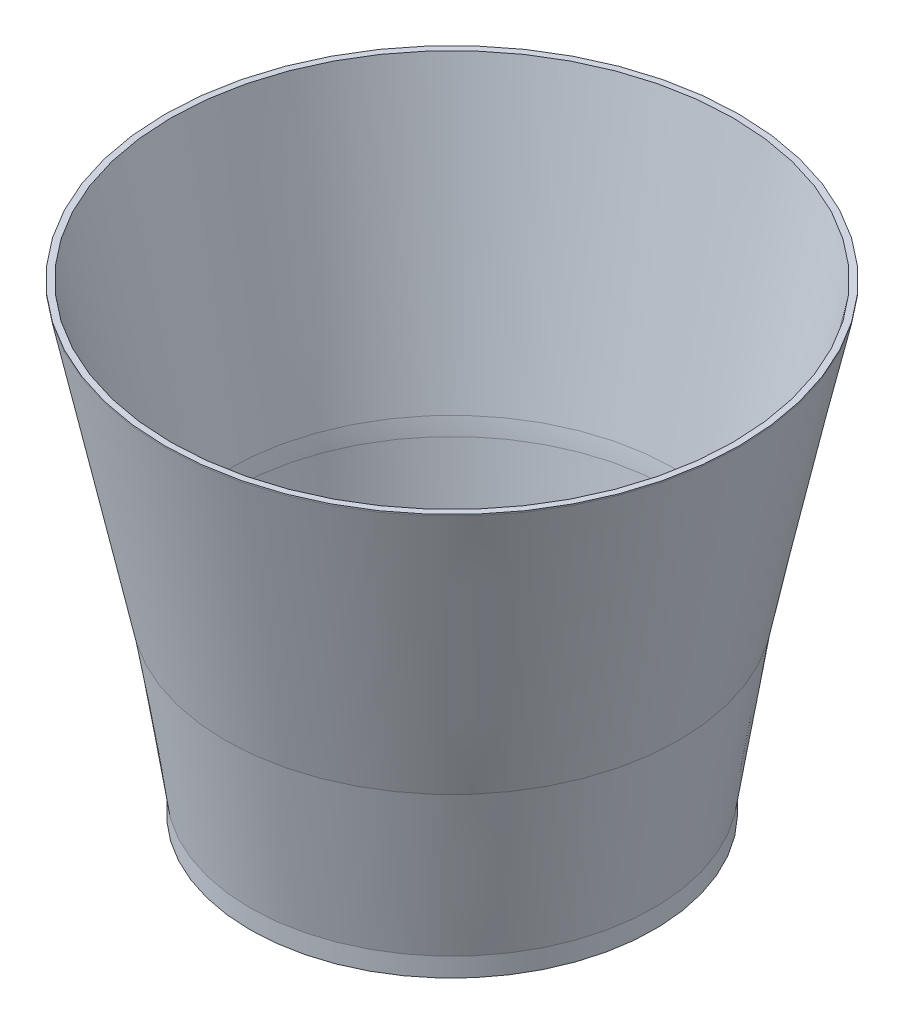
from build123d import *

# Parameters (mm, degrees)
SKETCH1_R           = 32
SKETCH1_R_2         = 2
SKETCH1_R_3         = 4
BOSS_EXTRUDE1_DEPTH = 3
FILLET1_R           = 50


with BuildPart() as part:
    # Sketch1 → Boss-Extrude1 (new body)
    with BuildSketch(Plane(origin=(0, 0, 0), x_dir=(1, 0, 0), z_dir=(0, 1, 0))):
        with Locations(Location((0, 0, 0), (0, 0, 270))):
            Circle(SKETCH1_R)
        with Locations(Location((0, 10, 0), (0, 0, 270))):
            Circle(SKETCH1_R_2, mode=Mode.SUBTRACT)
        with Locations(Location((0, -5, 0), (0, 0, 270))):
            Circle(SKETCH1_R_2, mode=Mode.SUBTRACT)
        with Locations(Location((0, 21.162401824, 0), (0, 0, 270))):
            Circle(SKETCH1_R_3, mode=Mode.SUBTRACT)
        with Locations(Location((16.54543199, 13.19454172, 0), (0, 0, 270))):
            Circle(SKETCH1_R_3, mode=Mode.SUBTRACT)
        with Locations(Location((20.631816227, -4.709077419, 0), (0, 0, 270))):
            Circle(SKETCH1_R_3, mode=Mode.SUBTRACT)
        with Locations(Location((9.182022032, -19.066665213, 0), (0, 0, 270))):
            Circle(SKETCH1_R_3, mode=Mode.SUBTRACT)
        with Locations(Location((-9.182022032, -19.066665213, 0), (0, 0, 270))):
            Circle(SKETCH1_R_3, mode=Mode.SUBTRACT)
        with Locations(Location((-20.631816227, -4.709077419, 0), (0, 0, 270))):
            Circle(SKETCH1_R_3, mode=Mode.SUBTRACT)
        with Locations(Location((-16.54543199, 13.19454172, 0), (0, 0, 270))):
            Circle(SKETCH1_R_3, mode=Mode.SUBTRACT)
    extrude(amount=BOSS_EXTRUDE1_DEPTH)

    # Sketch3 → Revolve2 (revolve)
    with BuildSketch(Plane(origin=(0, 0, 0), x_dir=(0, 0, -1), z_dir=(1, 0, 0))):
        Polygon((-32, 3), (-35.959611008, 28), (-34.959611008, 28), (-30.524846679, 0), (-32, 0), align=None)
    revolve(axis=Axis((0, 0, 0), (0, 1, 0)))

    # Sketch5 → Revolve3 (revolve)
    with BuildSketch(Plane(origin=(0, 0, 0), x_dir=(0, 0, -1), z_dir=(1, 0, 0)), mode=Mode.PRIVATE) as revolve3_sk:
        Polygon((-35.959611008, 28), (-45.524656283, 73), (-45.524656283, 73.207911691), (-44.546508683, 73.207911691), (-34.981463407, 28.207911691), (-34.959611008, 28), align=None)
    revolve(revolve3_sk.sketch.rotate(Axis((0, 0, 0), (0, 1, 0)), 180), axis=Axis((0, 0, 0), (0, 1, 0)))

    # Fillet1
    fillet1_edges = [part.edges().sort_by_distance(p)[0] for p in [
        (0, 28.207911691, 34.981463407),
    ]]
    fillet(fillet1_edges, radius=FILLET1_R)


solid = part.part
